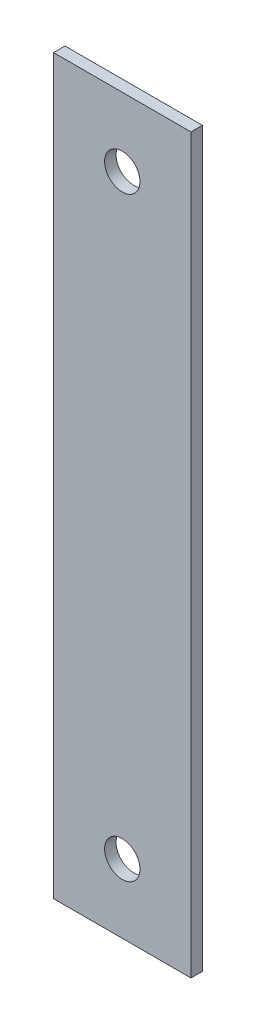
from build123d import *

# Parameters (mm, degrees)
SKETCH1_W                = 38.1
SKETCH1_H                = 203.2
BOSS_EXTRUDE1_DEPTH      = 3.175
W_0_386_DIAMETER_HOLE1_D = 9.8044


with BuildPart() as part:
    # Sketch1 → Boss-Extrude1 (new body)
    with BuildSketch(Plane.XY):
        with Locations((19.05, 101.6)):
            Rectangle(SKETCH1_W, SKETCH1_H)
    extrude(amount=BOSS_EXTRUDE1_DEPTH)

    # W (0.386) Diameter Hole1 (through all)
    with Locations(Plane.XY.offset(3.175)):
        with Locations((19.05, 184.15), (19.05, 19.05)):
            Hole(W_0_386_DIAMETER_HOLE1_D / 2)


solid = part.part
